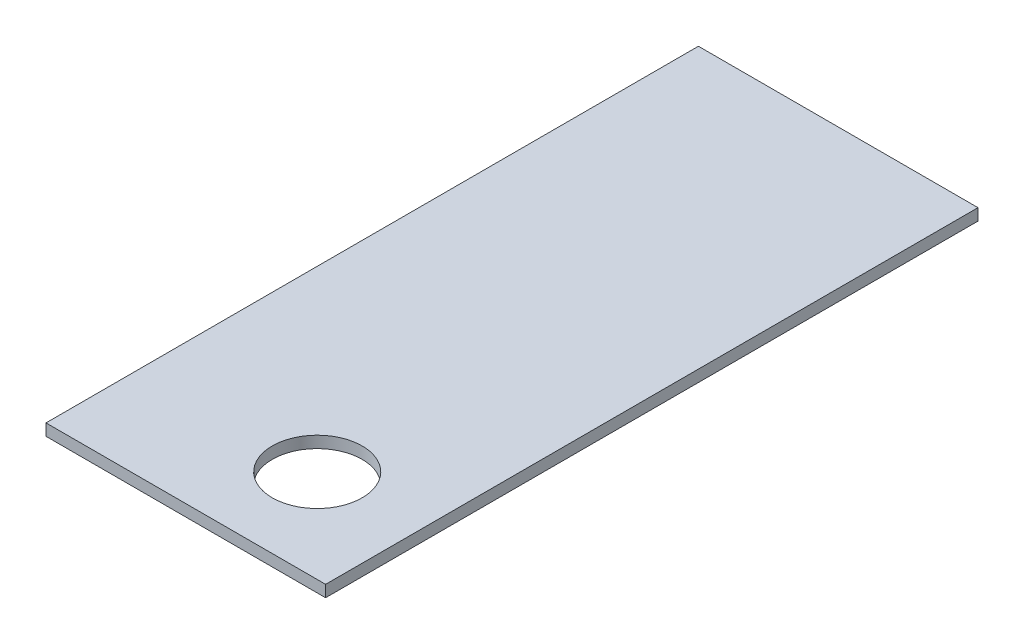
from build123d import *

# Parameters (mm, degrees)
SKETCH1_W           = 76.2
SKETCH1_H           = 177.8
SKETCH1_R           = 12.25
BOSS_EXTRUDE1_DEPTH = 3.175


with BuildPart() as part:
    # Sketch1 → Boss-Extrude1 (new body)
    with BuildSketch(Plane(origin=(0, 0, 0), x_dir=(1, 0, 0), z_dir=(0, 1, 0))):
        with Locations((38.1, 88.9)):
            Rectangle(SKETCH1_W, SKETCH1_H)
        with Locations(Location((48.514, 25.4, 0), (0, 0, 270))):
            Circle(SKETCH1_R, mode=Mode.SUBTRACT)
    extrude(amount=BOSS_EXTRUDE1_DEPTH)


solid = part.part
